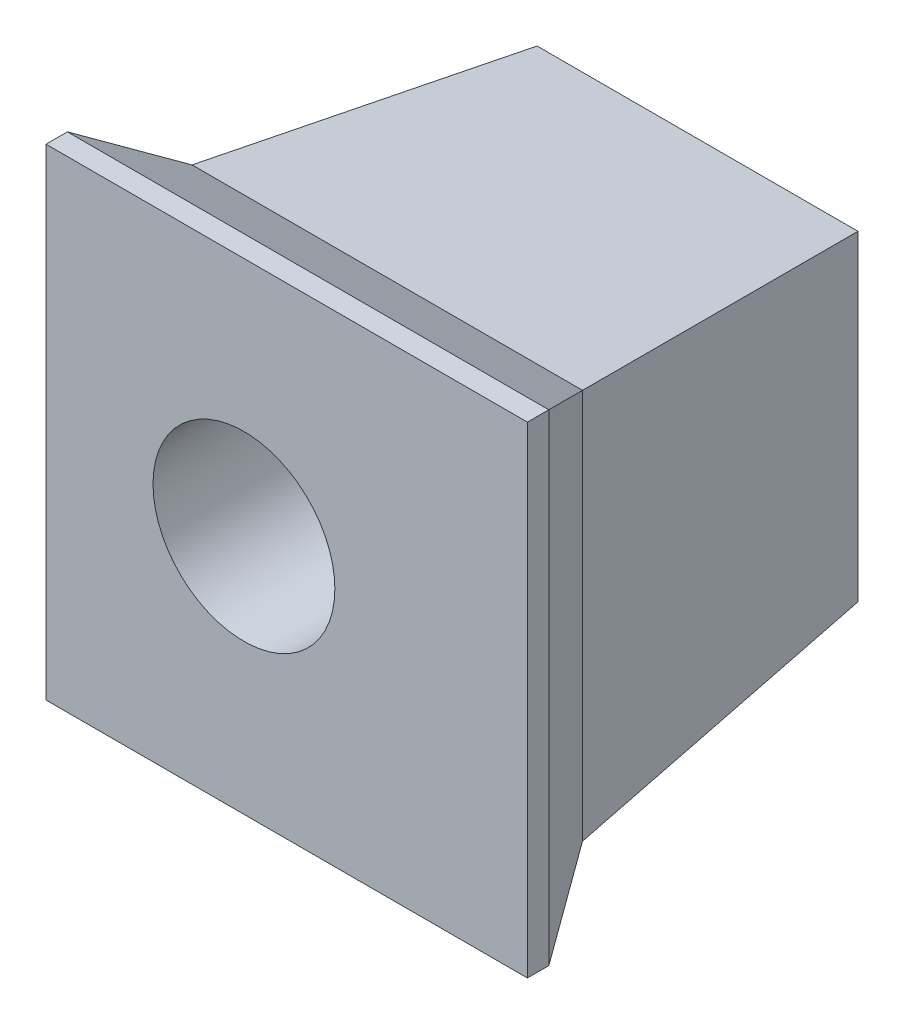
from build123d import *

# Parameters (mm, degrees)
SKETCH_4_R          = 8.5
CUT_EXTRUDE_1_DEPTH = 33.4
SKETCH_5_R          = 3
CUT_EXTRUDE_2_DEPTH = 33.4
EXTRUDE_START       = 2
SKETCH_6_W          = 45
SKETCH_6_H          = 45
SKETCH_6_R          = 8.5
EXTRUDE_1_DEPTH     = 2


with BuildPart() as part:
    # 草图1 → 放样1 section 0
    with BuildSketch(Plane.XY):
        with BuildLine():
            Line((-18.25, 18.25), (18.25, 18.25))
            Line((18.25, 18.25), (18.25, -18.25))
            Line((18.25, -18.25), (-18.25, -18.25))
            Line((-18.25, -18.25), (-18.25, 18.25))
        make_face()
    # 草图2 → 放样1 section 1
    with BuildSketch(Plane.XY.offset(7.4)):
        with BuildLine():
            Line((-22.5, 22.5), (22.5, 22.5))
            Line((22.5, 22.5), (22.5, -22.5))
            Line((22.5, -22.5), (-22.5, -22.5))
            Line((-22.5, -22.5), (-22.5, 22.5))
        make_face()
    loft()

    # 草图3 → section 0 of loft_2
    with BuildSketch(Plane(origin=(0, 0, -29), x_dir=(-1, 0, 0), z_dir=(0, 0, -1)), mode=Mode.PRIVATE) as loft_2_s0:
        with BuildLine():
            Line((-15, 15), (15, 15))
            Line((15, 15), (15, -15))
            Line((15, -15), (-15, -15))
            Line((-15, -15), (-15, 15))
        make_face()
    # loft up to a face of the part (loft_2)
    loft([loft_2_s0.sketch, part.faces().sort_by_distance((0, 0, 0))[0]])

    # 草图4 → 切除-拉伸1 (cut)
    with BuildSketch(Plane.XY.offset(7.4)):
        with Locations((-4, 0)):
            Circle(SKETCH_4_R)
    extrude(amount=-CUT_EXTRUDE_1_DEPTH, mode=Mode.SUBTRACT)

    # 草图5 → 切除-拉伸2 (cut)
    with BuildSketch(Plane.XY.offset(-26)):
        with Locations((-4, 0)):
            Circle(SKETCH_5_R)
    extrude(amount=-CUT_EXTRUDE_2_DEPTH, mode=Mode.SUBTRACT)

    # 草图6 → 凸台-拉伸1 (add)
    with BuildSketch(Plane.XY.offset(7.4).offset(EXTRUDE_START)):
        Rectangle(SKETCH_6_W, SKETCH_6_H)
        with Locations((-4, 0)):
            Circle(SKETCH_6_R, mode=Mode.SUBTRACT)
    extrude(amount=-EXTRUDE_1_DEPTH)


solid = part.part
